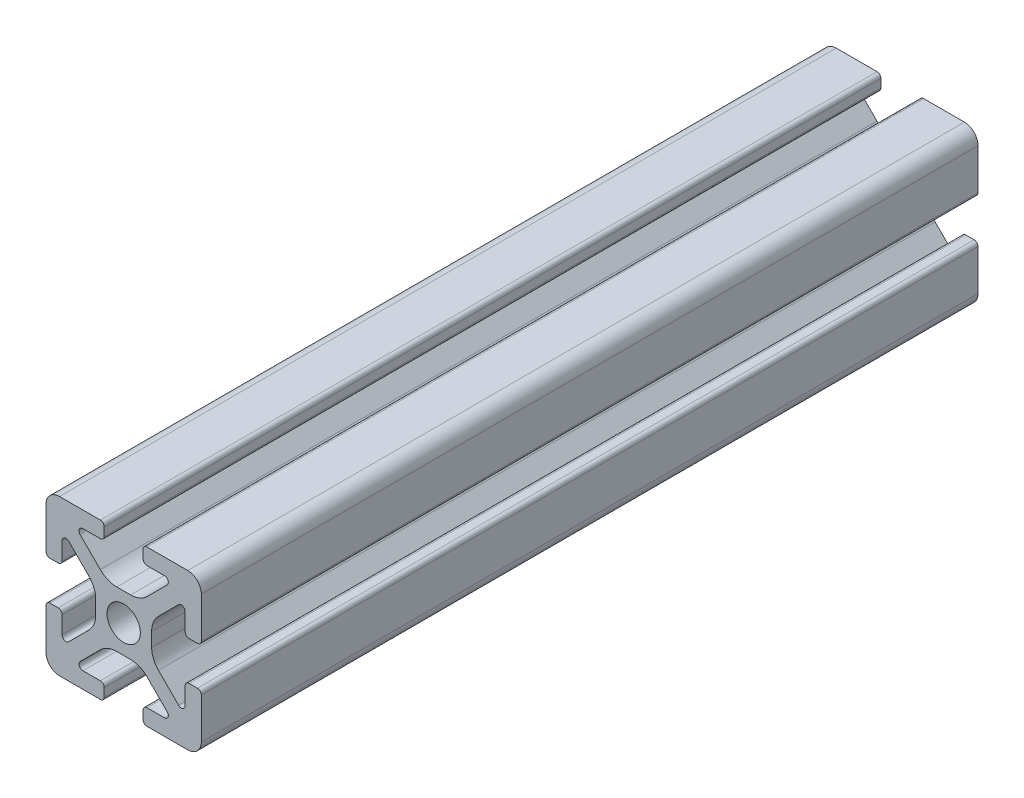
from build123d import *

# Parameters (mm, degrees)
BOSS_EXTRUDE1_DEPTH = 76.2
SKETCH5_W           = 27.787302718
SKETCH5_H           = 26.03929452
CUT_EXTRUDE1_DEPTH  = 52.4


with BuildPart() as part:
    # Sketch4 → Boss-Extrude1 (new, symmetric)
    with BuildSketch(Plane.XY):
        with BuildLine():
            Line((3, -10), (8.25, -10))
            ThreePointArc((8.25, -10), (9.487436867, -9.487436867), (10, -8.25))
            Line((10, -8.25), (10, -3))
            ThreePointArc((10, -3), (9.853553391, -2.646446609), (9.5, -2.5))
            Line((9.5, -2.5), (8.424621202, -2.5))
            ThreePointArc((8.424621202, -2.5), (8.071067812, -2.646446609), (7.924621202, -3))
            Line((7.924621202, -3), (7.924621202, -5.25))
            ThreePointArc((7.924621202, -5.25), (7.615962919, -5.711939766), (7.071067812, -5.603553391))
            Line((7.071067812, -5.603553391), (4.478679656, -3.011165235))
            ThreePointArc((4.478679656, -3.011165235), (3.828361402, -2.037895189), (3.6, -0.889844892))
            Line((3.6, -0.889844892), (3.6, 0))
            Line((3.6, 0), (2.15, 0))
            ThreePointArc((2.15, 0), (1.52027958, -1.52027958), (0, -2.15))
            Line((0, -2.15), (0, -3.6))
            Line((0, -3.6), (0.889844892, -3.6))
            ThreePointArc((0.889844892, -3.6), (2.037895189, -3.828361402), (3.011165235, -4.478679656))
            Line((3.011165235, -4.478679656), (5.603553391, -7.071067812))
            ThreePointArc((5.603553391, -7.071067812), (5.711939766, -7.615962919), (5.25, -7.924621202))
            Line((5.25, -7.924621202), (3, -7.924621202))
            ThreePointArc((3, -7.924621202), (2.646446609, -8.071067812), (2.5, -8.424621202))
            Line((2.5, -8.424621202), (2.5, -9.5))
            ThreePointArc((2.5, -9.5), (2.646446609, -9.853553391), (3, -10))
        make_face()
    extrude(amount=BOSS_EXTRUDE1_DEPTH, both=True)

    # Mirror1: part across plane


with BuildPart() as part_1:
    add(part.part)
    add(part.part.mirror(Plane(origin=(0, 0, 0), x_dir=(0, 0, 1), z_dir=(1, 0, 0))))

    # Mirror2: part across plane


with BuildPart() as part_2:
    add(part_1.part)
    add(part_1.part.mirror(Plane.ZX))

    # Sketch5 → Cut-Extrude1 (cut)
    with BuildSketch(Plane.XY.offset(76.2)):
        with Locations((-0.060276145, -0.663037592)):
            Rectangle(SKETCH5_W, SKETCH5_H)
    extrude(amount=-CUT_EXTRUDE1_DEPTH, mode=Mode.SUBTRACT)


solid = part_2.part
